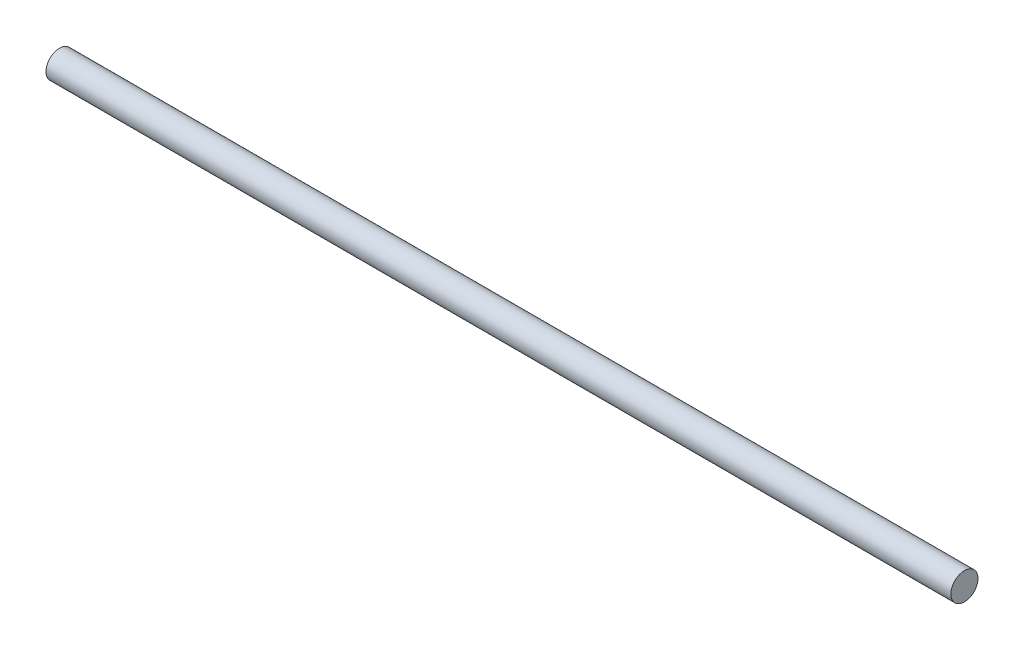
from build123d import *

# Parameters (mm, degrees)
SKETCH1_R           = 9
BOSS_EXTRUDE1_DEPTH = 300


with BuildPart() as part:
    # Sketch1 → Boss-Extrude1 (new, symmetric)
    with BuildSketch(Plane(origin=(0, 0, 0), x_dir=(0, 0, -1), z_dir=(1, 0, 0))):
        Circle(SKETCH1_R)
    extrude(amount=BOSS_EXTRUDE1_DEPTH, both=True)


solid = part.part
